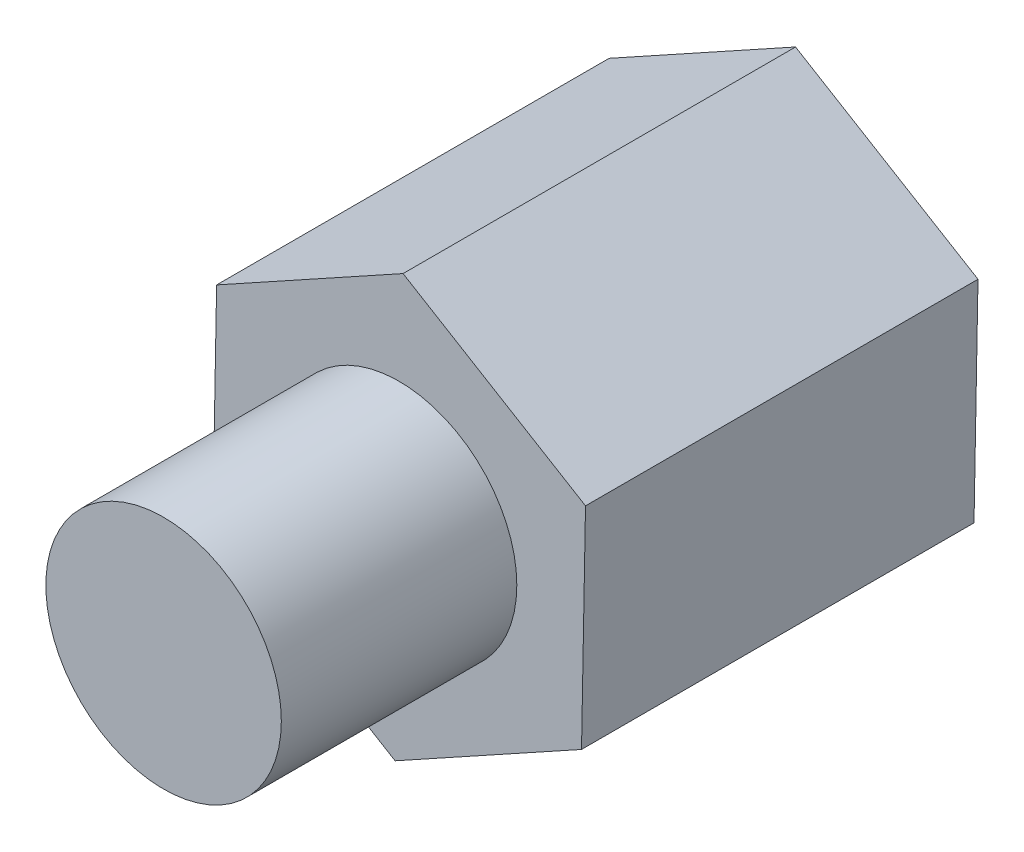
from build123d import *

# Parameters (mm, degrees)
EXTRUDE_1_DEPTH     = 5
SKETCH_2_R          = 1.5
EXTRUDE_2_DEPTH     = 3
SKETCH_3_R          = 1.5
CUT_EXTRUDE_1_DEPTH = 3


with BuildPart() as part:
    # 草图1 → 凸台-拉伸1 (new body)
    with BuildSketch(Plane.XY):
        Polygon((-2.324213399, 1.400487561), (-2.374964505, -1.312584067), (-0.050751106, -2.713071628), (2.324213399, -1.400487561), (2.374964505, 1.312584067), (0.050751106, 2.713071628), align=None)
    extrude(amount=EXTRUDE_1_DEPTH)

    # 草图2 → 凸台-拉伸2 (add)
    with BuildSketch(Plane.XY.offset(5)):
        Circle(SKETCH_2_R)
    extrude(amount=EXTRUDE_2_DEPTH)

    # 草图3 → 切除-拉伸1 (cut)
    with BuildSketch(Plane(origin=(0, 0, 0), x_dir=(-1, 0, 0), z_dir=(0, 0, -1))):
        with Locations(Location((0, 0, 0), (0, 0, 180))):
            Circle(SKETCH_3_R)
    extrude(amount=-CUT_EXTRUDE_1_DEPTH, mode=Mode.SUBTRACT)


solid = part.part
